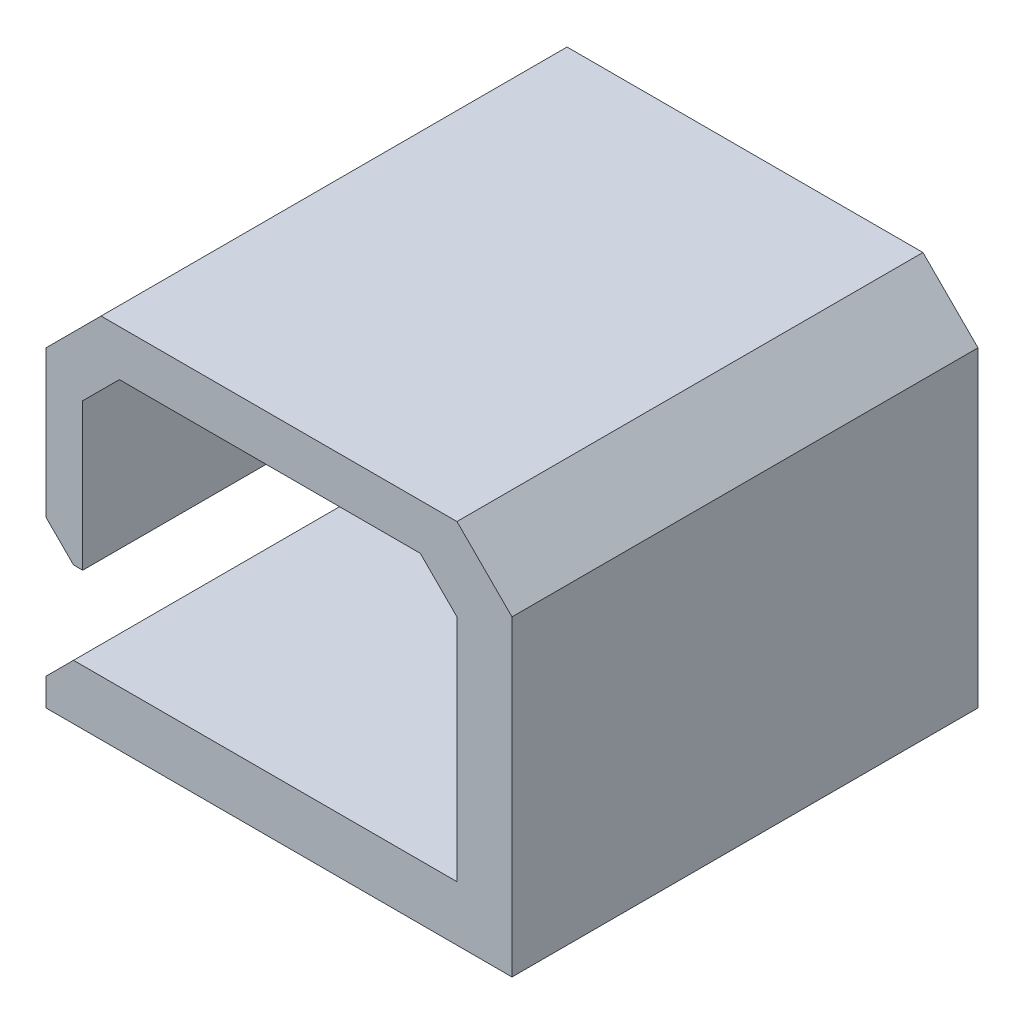
from build123d import *

# Parameters (mm, degrees)
SKETCH1_W           = 25.4
SKETCH1_H           = 25.4
BOSS_EXTRUDE1_DEPTH = 3
SKETCH2_W           = 3
SKETCH2_H           = 25.4
BOSS_EXTRUDE2_DEPTH = 17
SKETCH3_W           = 25.4
SKETCH3_H           = 2.5
BOSS_EXTRUDE3_DEPTH = 22.4
SKETCH4_W           = 2
SKETCH4_H           = 25.4
BOSS_EXTRUDE4_DEPTH = 10
CHAMFER1_SIZE       = 1.5
CHAMFER2_SIZE       = 3
CHAMFER3_SIZE       = 2
CHAMFER4_SIZE       = 1.5


with BuildPart() as part:
    # Sketch1 → Boss-Extrude1 (new body)
    with BuildSketch(Plane(origin=(0, 0, 0), x_dir=(1, 0, 0), z_dir=(0, 1, 0))):
        Rectangle(SKETCH1_W, SKETCH1_H)
    extrude(amount=BOSS_EXTRUDE1_DEPTH)

    # Sketch2 → Boss-Extrude2 (add)
    with BuildSketch(Plane(origin=(0, 3, 0), x_dir=(1, 0, 0), z_dir=(0, 1, 0))):
        with Locations((11.2, 0)):
            Rectangle(SKETCH2_W, SKETCH2_H)
    extrude(amount=BOSS_EXTRUDE2_DEPTH)

    # Sketch3 → Boss-Extrude3 (add)
    with BuildSketch(Plane.ZY.offset(-9.7)):
        with Locations((0, 18.75)):
            Rectangle(SKETCH3_W, SKETCH3_H)
    extrude(amount=BOSS_EXTRUDE3_DEPTH)

    # Sketch4 → Boss-Extrude4 (add)
    with BuildSketch(Plane.XZ.offset(-17.5)):
        with Locations((-11.7, 0)):
            Rectangle(SKETCH4_W, SKETCH4_H)
    extrude(amount=BOSS_EXTRUDE4_DEPTH)

    # Chamfer1
    chamfer1_edges = [part.edges().sort_by_distance(p)[0] for p in [
        (-12.7, 7.5, 0),
    ]]
    chamfer(chamfer1_edges, length=CHAMFER1_SIZE)

    # Chamfer2
    chamfer2_edges = [part.edges().sort_by_distance(p)[0] for p in [
        (12.7, 20, 0),
        (-12.7, 20, 0),
    ]]
    chamfer(chamfer2_edges, length=CHAMFER2_SIZE)

    # Chamfer3
    chamfer3_edges = [part.edges().sort_by_distance(p)[0] for p in [
        (9.7, 17.5, 0),
        (-10.7, 17.5, 0),
    ]]
    chamfer(chamfer3_edges, length=CHAMFER3_SIZE)

    # Chamfer4
    chamfer4_edges = [part.edges().sort_by_distance(p)[0] for p in [
        (-12.7, 3, 0),
    ]]
    chamfer(chamfer4_edges, length=CHAMFER4_SIZE)


solid = part.part
